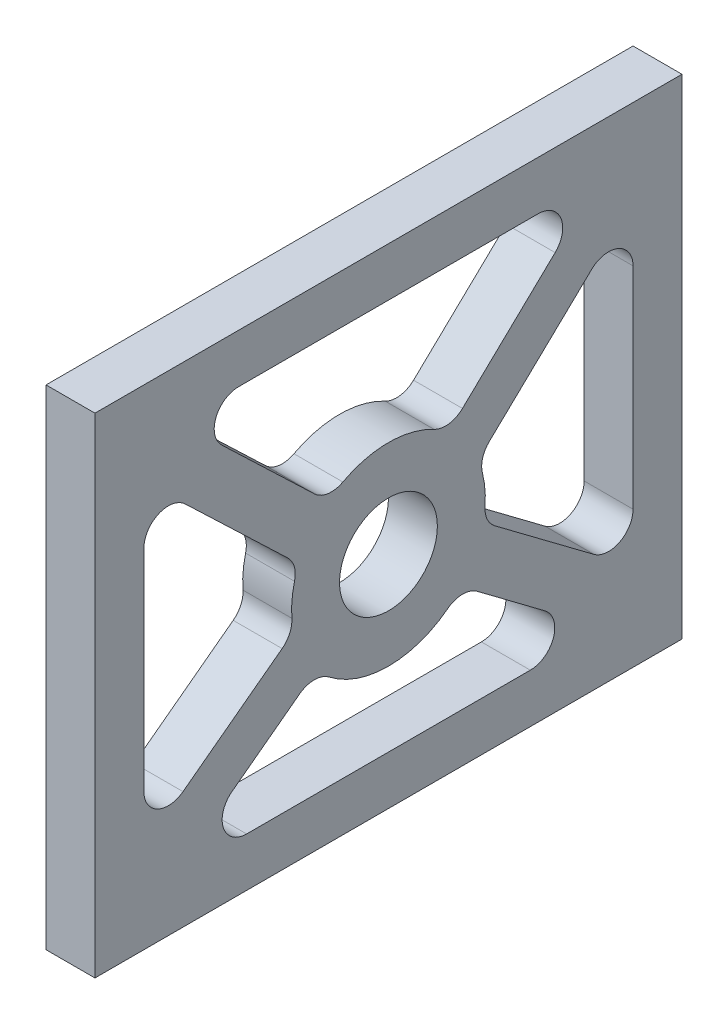
from build123d import *

# Parameters (mm, degrees)
SKETCH1_W           = 76.2
SKETCH1_H           = 63.5
SKETCH1_R           = 6.35
BOSS_EXTRUDE1_DEPTH = 6.35
CUT_EXTRUDE1_REACH  = 54.074
FILLET2_R           = 3.175


with BuildPart() as part:
    # Sketch1 → Boss-Extrude1 (new body)
    with BuildSketch(Plane(origin=(0, 0, 0), x_dir=(0, 0, -1), z_dir=(1, 0, 0))):
        with Locations((0, 3.175)):
            Rectangle(SKETCH1_W, SKETCH1_H)
        Circle(SKETCH1_R, mode=Mode.SUBTRACT)
    extrude(amount=BOSS_EXTRUDE1_DEPTH)

    # Sketch4 → Cut-Extrude1 (cut, up to next)
    with BuildSketch(Plane(origin=(6.35, 0, 0), x_dir=(0, 0, -1), z_dir=(1, 0, 0)), mode=Mode.PRIVATE) as cut_extrude1_sk1:
        with BuildLine():
            Line((-9.415500655, -8.336066847), (-27.940897809, -22.225))
            Line((-27.940897809, -22.225), (27.940897809, -22.225))
            Line((27.940897809, -22.225), (9.415500655, -8.336066847))
            ThreePointArc((9.415500655, -8.336066847), (0, -12.575438882), (-9.415500655, -8.336066847))
        make_face()
    cut_extrude1_tool1 = extrude(cut_extrude1_sk1.sketch, amount=-CUT_EXTRUDE1_REACH, mode=Mode.PRIVATE) & part.part
    # Sketch4 → Cut-Extrude1 (cut, up to next)
    with BuildSketch(Plane(origin=(6.35, 0, 0), x_dir=(0, 0, -1), z_dir=(1, 0, 0)), mode=Mode.PRIVATE) as cut_extrude1_sk2:
        with BuildLine():
            Line((-12.310078524, -2.569752866), (-31.75, -17.144326768))
            Line((-31.75, -17.144326768), (-31.75, 23.984763034))
            Line((-31.75, 23.984763034), (-11.639261898, 4.761223113))
            ThreePointArc((-11.639261898, 4.761223113), (-12.523119774, 1.145920677), (-12.310078524, -2.569752866))
        make_face()
    cut_extrude1_tool2 = extrude(cut_extrude1_sk2.sketch, amount=-CUT_EXTRUDE1_REACH, mode=Mode.PRIVATE) & part.part
    # Sketch4 → Cut-Extrude1 (cut, up to next)
    with BuildSketch(Plane(origin=(6.35, 0, 0), x_dir=(0, 0, -1), z_dir=(1, 0, 0)), mode=Mode.PRIVATE) as cut_extrude1_sk3:
        with BuildLine():
            Line((-27.362264298, 28.575), (-7.793369677, 9.869399786))
            ThreePointArc((-7.793369677, 9.869399786), (0, 12.575438882), (7.793369677, 9.869399786))
            Line((7.793369677, 9.869399786), (27.362264298, 28.575))
            Line((27.362264298, 28.575), (-27.362264298, 28.575))
        make_face()
    cut_extrude1_tool3 = extrude(cut_extrude1_sk3.sketch, amount=-CUT_EXTRUDE1_REACH, mode=Mode.PRIVATE) & part.part
    # Sketch4 → Cut-Extrude1 (cut, up to next)
    with BuildSketch(Plane(origin=(6.35, 0, 0), x_dir=(0, 0, -1), z_dir=(1, 0, 0)), mode=Mode.PRIVATE) as cut_extrude1_sk4:
        with BuildLine():
            Line((31.75, 23.984763034), (11.639261898, 4.761223113))
            ThreePointArc((11.639261898, 4.761223113), (12.523119774, 1.145920677), (12.310078524, -2.569752866))
            Line((12.310078524, -2.569752866), (31.75, -17.144326768))
            Line((31.75, -17.144326768), (31.75, 23.984763034))
        make_face()
    cut_extrude1_tool4 = extrude(cut_extrude1_sk4.sketch, amount=-CUT_EXTRUDE1_REACH, mode=Mode.PRIVATE) & part.part
    add(cut_extrude1_tool1.solids().sort_by_distance((6.35, -17.188664, 0))[0], mode=Mode.SUBTRACT)
    add(cut_extrude1_tool2.solids().sort_by_distance((6.35, 2.651872, 24.218351))[0], mode=Mode.SUBTRACT)
    add(cut_extrude1_tool3.solids().sort_by_distance((6.35, 21.415116, 0))[0], mode=Mode.SUBTRACT)
    add(cut_extrude1_tool4.solids().sort_by_distance((6.35, 2.651872, -24.218351))[0], mode=Mode.SUBTRACT)

    # Fillet2
    fillet2_edges = [part.edges().sort_by_distance(p)[0] for p in [
        (3.175, 4.761223113, 11.639261898),
        (3.175, -2.569752866, 12.310078524),
        (3.175, -17.144326768, 31.75),
        (3.175, 23.984763034, 31.75),
        (3.175, -8.336066847, 9.415500655),
        (3.175, -8.336066847, -9.415500655),
        (3.175, -22.225, -27.940897809),
        (3.175, -22.225, 27.940897809),
        (3.175, 28.575, 27.362264298),
        (3.175, 28.575, -27.362264298),
        (3.175, 9.869399786, -7.793369677),
        (3.175, 9.869399786, 7.793369677),
        (3.175, 23.984763034, -31.75),
        (3.175, -17.144326768, -31.75),
        (3.175, -2.569752866, -12.310078524),
        (3.175, 4.761223113, -11.639261898),
    ]]
    fillet(fillet2_edges, radius=FILLET2_R)


solid = part.part
